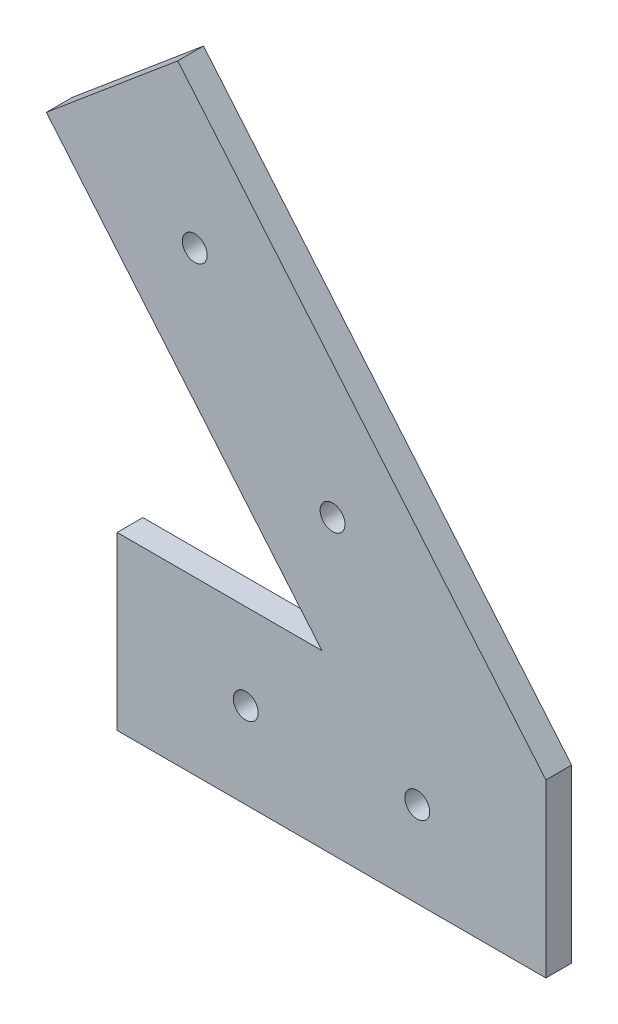
from build123d import *

# Parameters (mm, degrees)
SKETCH1_R           = 1.45
BOSS_EXTRUDE1_DEPTH = 3


with BuildPart() as part:
    # Sketch1 → Boss-Extrude1 (new body)
    with BuildSketch(Plane.XY):
        Polygon((0, 0), (32.139380484, -38.302222156), (8.247526271, -38.302222156), (8.247526271, -58.302222156), (58.247526271, -58.302222156), (58.247526271, -38.302222156), (15.320888862, 12.855752194), align=None)
        with Locations((23.247526271, -48.302222156)):
            Circle(SKETCH1_R, mode=Mode.SUBTRACT)
        with Locations((43.247526271, -48.302222156)):
            Circle(SKETCH1_R, mode=Mode.SUBTRACT)
        with Locations((17.302258576, -5.06279055)):
            Circle(SKETCH1_R, mode=Mode.SUBTRACT)
        with Locations((33.371948819, -24.213901628)):
            Circle(SKETCH1_R, mode=Mode.SUBTRACT)
    extrude(amount=BOSS_EXTRUDE1_DEPTH)


solid = part.part
